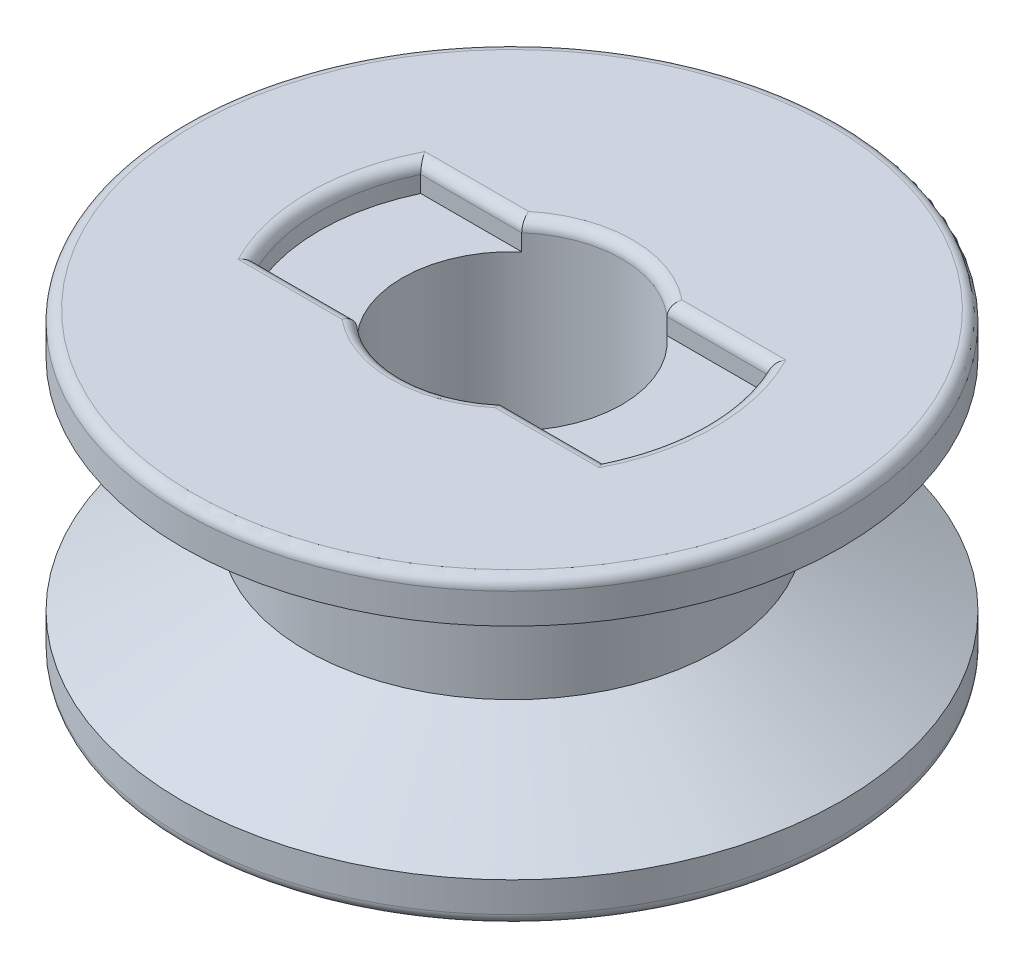
from build123d import *

# Parameters (mm, degrees)
CUT_EXTRUDE_1_DEPTH = 0.5
SKETCH_3_R          = 2
CUT_EXTRUDE_2_DEPTH = 11.111874208
FILLET_1_R          = 0.2


with BuildPart() as part:
    # 草图1 → 旋转1 (revolve)
    with BuildSketch(Plane.XY, mode=Mode.PRIVATE) as revolve_1_sk:
        Polygon((0, 0), (3.75, 0), (3.75, 0.75), (6, 2), (6, 2.75), (0, 2.75), align=None)
    revolve_1 = revolve(revolve_1_sk.sketch.rotate(Axis((0, 2.75, 0), (0, -1, 0)), 180), axis=Axis((0, 2.75, 0), (0, -1, 0)))

    # 镜向1: 旋转1 across plane
    add(revolve_1.mirror(Plane.ZX))

    # 草图2 → 切除-拉伸1 (cut)
    with BuildSketch(Plane(origin=(0, 2.75, 0), x_dir=(1, 0, 0), z_dir=(0, 1, 0))):
        with BuildLine():
            Line((3.16227766, 1.5), (-3.16227766, 1.5))
            ThreePointArc((-3.16227766, 1.5), (-3.5, 0), (-3.16227766, -1.5))
            Line((-3.16227766, -1.5), (3.16227766, -1.5))
            ThreePointArc((3.16227766, -1.5), (3.5, 0), (3.16227766, 1.5))
        make_face()
    cut_extrude_1 = extrude(amount=-CUT_EXTRUDE_1_DEPTH, mode=Mode.SUBTRACT)

    # 镜向2: 切除-拉伸1 across plane
    add(cut_extrude_1.mirror(Plane.ZX), mode=Mode.SUBTRACT)

    # 草图3 → 切除-拉伸2 (cut, through all)
    with BuildSketch(Plane(origin=(0, 2.75, 0), x_dir=(1, 0, 0), z_dir=(0, 1, 0))):
        with Locations(Location((0, 0, 0), (0, 0, 228.590377891))):
            Circle(SKETCH_3_R)
    extrude(amount=-CUT_EXTRUDE_2_DEPTH, mode=Mode.SUBTRACT)

    # 圆角1
    fillet_1_edges = [part.edges().sort_by_distance(p)[0] for p in [
        (6, -2.75, 0),
        (3.5, 2.75, 0),
        (2.242576658, 2.75, -1.5),
        (-3.5, 2.75, 0),
        (-2.242576658, 2.75, 1.5),
        (3.5, -2.75, 0),
        (2.242576658, -2.75, -1.5),
        (-3.5, -2.75, 0),
        (-2.242576658, -2.75, 1.5),
        (2.242576658, -2.75, 1.5),
        (-2.242576658, -2.75, -1.5),
        (6, 2.75, 0),
        (-2.242576658, 2.75, -1.5),
        (2.242576658, 2.75, 1.5),
        (0, 2.75, 2),
        (0, 2.75, -2),
        (0, -2.75, 2),
        (0, -2.75, -2),
    ]]
    fillet(fillet_1_edges, radius=FILLET_1_R)


solid = part.part
